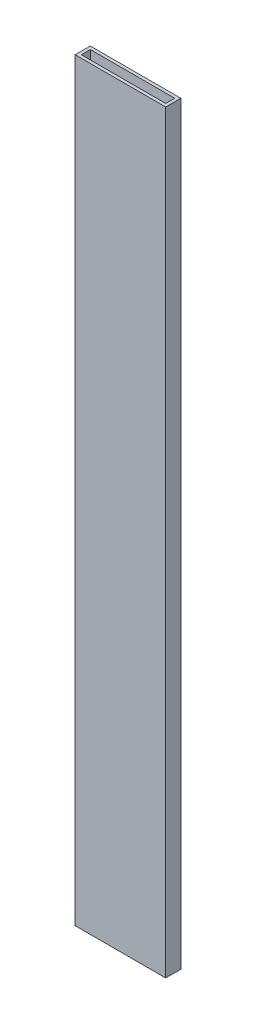
from build123d import *

# Parameters (mm, degrees)
SKETCH_1_W      = 60
SKETCH_1_H      = 10
SKETCH_1_W_2    = 56
SKETCH_1_H_2    = 6
EXTRUDE_1_DEPTH = 500


with BuildPart() as part:
    # Эскиз1 → Бобышка-Вытянуть1 (new body)
    with BuildSketch(Plane(origin=(0, 0, 0), x_dir=(1, 0, 0), z_dir=(0, 1, 0))):
        with Locations((30, 5)):
            Rectangle(SKETCH_1_W, SKETCH_1_H)
        with Locations((30, 5)):
            Rectangle(SKETCH_1_W_2, SKETCH_1_H_2, mode=Mode.SUBTRACT)
    extrude(amount=EXTRUDE_1_DEPTH)


solid = part.part
